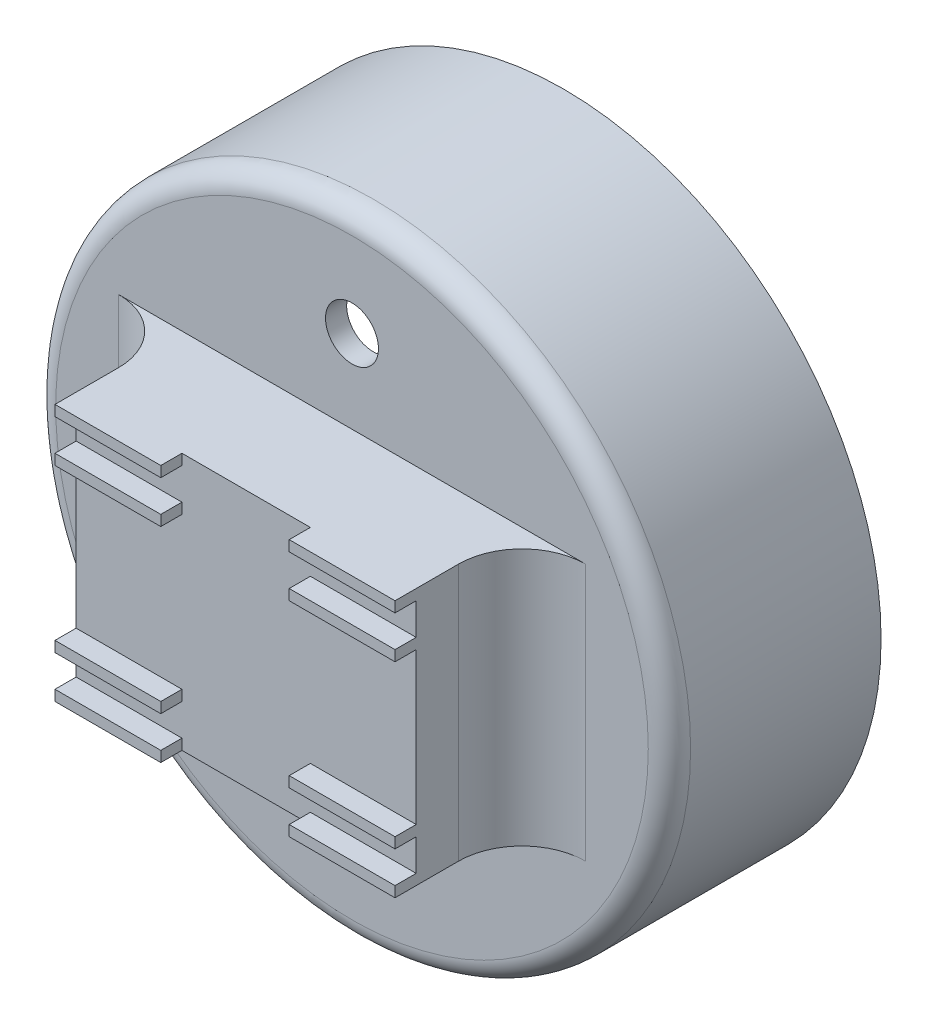
from build123d import *

# Parameters (mm, degrees)
SKETCH1_R           = 38.1
BOSS_EXTRUDE1_DEPTH = 25.4
SHELL1_T            = -2.54
FILLET1_R           = 2.54
SKETCH2_R           = 3.175
CUT_EXTRUDE1_DEPTH  = 60.568280214
CIRPATTERN1_COUNT   = 4
SKETCH3_W           = 40.812489524
SKETCH3_H           = 30.878008928
BOSS_EXTRUDE2_DEPTH = 12.7
SKETCH6_R           = 3.175
BOSS_EXTRUDE4_DEPTH = 2.54
FILLET3_R           = 7.62
SKETCH8_W           = 40.812489524
SKETCH8_H           = 1.27
BOSS_EXTRUDE7_DEPTH = 2.54
SKETCH9_W           = 15.412489524
SKETCH9_H           = 30.878008928
CUT_EXTRUDE2_DEPTH  = 2.54


with BuildPart() as part:
    # Sketch1 → Boss-Extrude1 (new body)
    with BuildSketch(Plane.XY):
        with Locations(Location((0, 0, 0), (0, 0, 180))):
            Circle(SKETCH1_R)
    extrude(amount=BOSS_EXTRUDE1_DEPTH)

    # Shell1
    shell1_openings = [part.faces().sort_by_distance(p)[0] for p in [
        (0, 0, 0),
    ]]
    offset(amount=SHELL1_T, openings=shell1_openings, kind=Kind.INTERSECTION)

    # Fillet1
    fillet1_edges = [part.edges().sort_by_distance(p)[0] for p in [
        (38.1, 0, 25.4),
    ]]
    fillet(fillet1_edges, radius=FILLET1_R)

    # Sketch2 → Cut-Extrude1 (cut, through all)
    with BuildSketch(Plane.XY.offset(25.4)):
        with Locations((0, 25.4)):
            Circle(SKETCH2_R)
    cut_extrude1 = extrude(amount=-CUT_EXTRUDE1_DEPTH, mode=Mode.SUBTRACT)

    # CirPattern1: Cut-Extrude1 ×4 about axis
    cirpattern1_axis = Axis((0, 0, 0), (0, 0, 1))
    for i in range(1, CIRPATTERN1_COUNT):
        add(cut_extrude1.rotate(cirpattern1_axis, i * 360 / CIRPATTERN1_COUNT), mode=Mode.SUBTRACT)

    # Sketch3 → Boss-Extrude2 (add)
    with BuildSketch(Plane.XY.offset(25.4)):
        Rectangle(SKETCH3_W, SKETCH3_H)
    extrude(amount=BOSS_EXTRUDE2_DEPTH)

    # Sketch6 → Boss-Extrude4 (add)
    with BuildSketch(Plane.XY.offset(25.4)):
        with Locations((25.4, 0)):
            Circle(SKETCH6_R)
        with Locations((-25.4, 0)):
            Circle(SKETCH6_R)
    extrude(amount=-BOSS_EXTRUDE4_DEPTH)

    # Fillet3
    fillet3_edges = [part.edges().sort_by_distance(p)[0] for p in [
        (20.406244762, 0, 25.4),
        (-20.406244762, 0, 25.4),
    ]]
    fillet(fillet3_edges, radius=FILLET3_R)

    # Sketch8 → Boss-Extrude7 (add)
    with BuildSketch(Plane.XY.offset(38.1)):
        with Locations((0, 14.804004464)):
            Rectangle(SKETCH8_W, SKETCH8_H)
        with Locations((0, 9.724004464)):
            Rectangle(SKETCH8_W, SKETCH8_H)
        with Locations((0, -9.724004464)):
            Rectangle(SKETCH8_W, SKETCH8_H)
        with Locations((0, -14.804004464)):
            Rectangle(SKETCH8_W, SKETCH8_H)
    extrude(amount=BOSS_EXTRUDE7_DEPTH)

    # Sketch9 → Cut-Extrude2 (cut)
    with BuildSketch(Plane.XY.offset(40.64)):
        Rectangle(SKETCH9_W, SKETCH9_H)
    extrude(amount=-CUT_EXTRUDE2_DEPTH, mode=Mode.SUBTRACT)


solid = part.part
